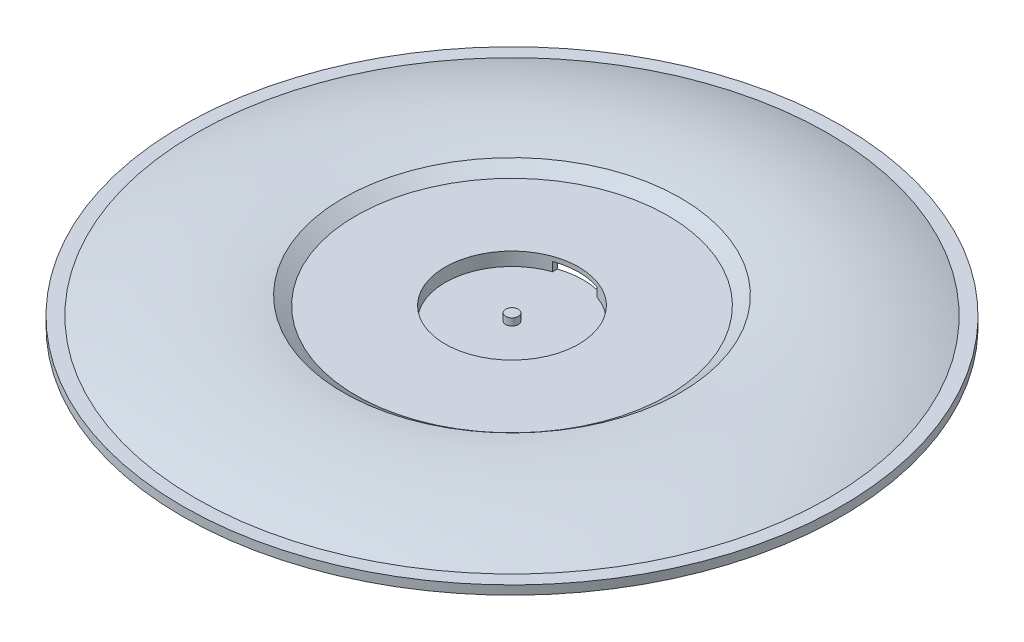
from build123d import *

# Parameters (mm, degrees)
SKETCH2_W          = 5
SKETCH2_H          = 1
CUT_EXTRUDE1_DEPTH = 15
SKETCH3_W          = 0.7
SKETCH3_H          = 0.8


with BuildPart() as part:
    # Sketch1 → Revolve1 (revolve)
    with BuildSketch(Plane.XY, mode=Mode.PRIVATE) as revolve1_sk:
        with BuildLine():
            Line((0, 0.5), (7.5, 0.5))
            Line((7.5, 0.5), (7.5, 2))
            Line((7.5, 2), (17.5, 2))
            Line((17.5, 2), (18.928148007, 3))
            ThreePointArc((18.928148007, 3), (27.342618843, 3.065113029), (35.5, 1))
            Line((35.5, 1), (37, 1))
            Line((37, 1), (37, 0))
            Line((37, 0), (36.5, 0))
            Line((36.5, 0), (36.5, 0.5))
            Line((36.5, 0.5), (35.404554146, 0.5))
            ThreePointArc((35.404554146, 0.5), (27.389609996, 2.555633943), (19.115328234, 2.520677712))
            Line((19.115328234, 2.520677712), (17.657649394, 1.5))
            Line((17.657649394, 1.5), (8, 1.5))
            Line((8, 1.5), (8, 0))
            Line((8, 0), (0, 0))
            Line((0, 0), (0, 0.5))
        make_face()
    revolve(revolve1_sk.sketch.rotate(Axis((0, 0, 0), (0, 1, 0)), 90), axis=Axis((0, 0, 0), (0, 1, 0)))

    # Sketch2 → Cut-Extrude1 (cut, symmetric)
    with BuildSketch(Plane.XY):
        with Locations((0, 1)):
            Rectangle(SKETCH2_W, SKETCH2_H)
    extrude(amount=CUT_EXTRUDE1_DEPTH, both=True, mode=Mode.SUBTRACT)

    # Sketch3 → Revolve2 (revolve)
    with BuildSketch(Plane.XY, mode=Mode.PRIVATE) as revolve2_sk:
        with Locations((0.35, 0.9)):
            Rectangle(SKETCH3_W, SKETCH3_H)
    revolve(revolve2_sk.sketch.rotate(Axis((0, 0.5, 0), (0, 1, 0)), 90), axis=Axis((0, 0.5, 0), (0, 1, 0)))


solid = part.part
